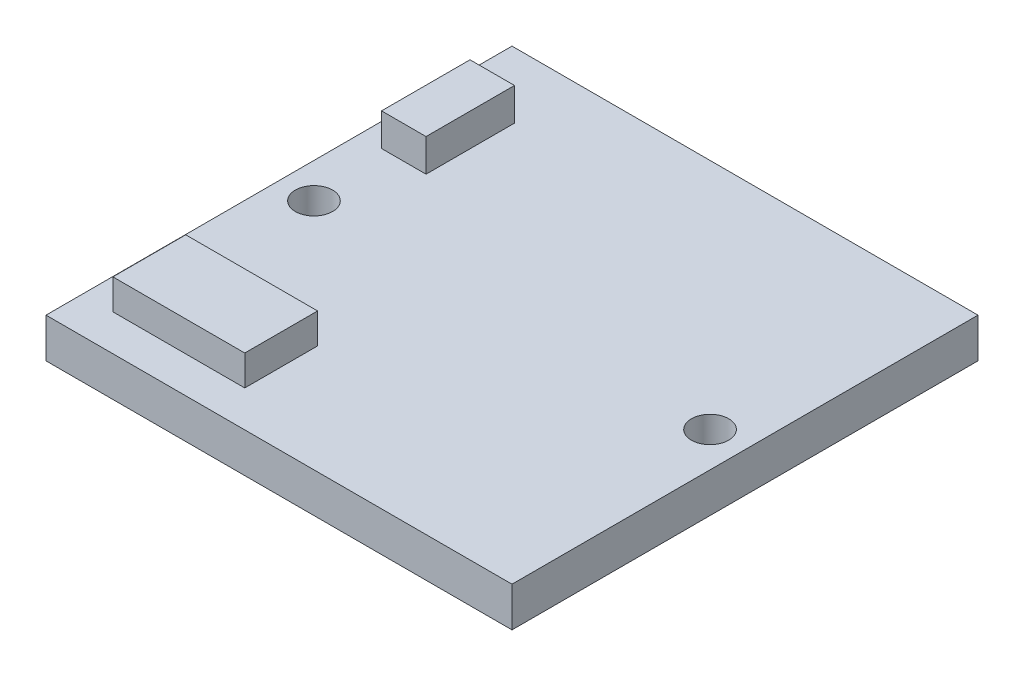
from build123d import *

# Parameters (mm, degrees)
SKETCH_1_W          = 20
SKETCH_1_H          = 20
EXTRUDE_1_DEPTH     = 1.7
SKETCH_2_W          = 0.7
SKETCH_2_H          = 1.5
CUT_EXTRUDE_1_DEPTH = 0.05
SKETCH_3_R          = 0.8
CUT_EXTRUDE_2_DEPTH = 29.335313656
SKETCH_6_W          = 5.659546013
SKETCH_6_H          = 3.125880025
EXTRUDE_4_DEPTH     = 1.3
SKETCH_7_W          = 1.909465354
SKETCH_7_H          = 3.796411433
EXTRUDE_5_DEPTH     = 1.4


with BuildPart() as part:
    # 스케치1 → 보스-돌출1 (new body)
    with BuildSketch(Plane(origin=(0, 0, 0), x_dir=(1, 0, 0), z_dir=(0, 1, 0))):
        with Locations((10, 10)):
            Rectangle(SKETCH_1_W, SKETCH_1_H)
    extrude(amount=EXTRUDE_1_DEPTH)

    # 스케치2 → 컷-돌출1 (cut)
    with BuildSketch(Plane(origin=(0, 0, 0), x_dir=(1, 0, 0), z_dir=(0, 1, 0))):
        with Locations((2.38, 2.75)):
            Rectangle(SKETCH_2_W, SKETCH_2_H)
        with Locations((3.65, 2.75)):
            Rectangle(SKETCH_2_W, SKETCH_2_H)
        with Locations((4.92, 2.75)):
            Rectangle(SKETCH_2_W, SKETCH_2_H)
        with Locations((6.19, 2.75)):
            Rectangle(SKETCH_2_W, SKETCH_2_H)
        with Locations((7.46, 2.75)):
            Rectangle(SKETCH_2_W, SKETCH_2_H)
        with Locations((8.73, 2.75)):
            Rectangle(SKETCH_2_W, SKETCH_2_H)
        with Locations((10, 2.75)):
            Rectangle(SKETCH_2_W, SKETCH_2_H)
        with Locations((11.27, 2.75)):
            Rectangle(SKETCH_2_W, SKETCH_2_H)
        with Locations((12.54, 2.75)):
            Rectangle(SKETCH_2_W, SKETCH_2_H)
        with Locations((13.81, 2.75)):
            Rectangle(SKETCH_2_W, SKETCH_2_H)
        with Locations((15.08, 2.75)):
            Rectangle(SKETCH_2_W, SKETCH_2_H)
        with Locations((16.35, 2.75)):
            Rectangle(SKETCH_2_W, SKETCH_2_H)
        with Locations((17.62, 2.75)):
            Rectangle(SKETCH_2_W, SKETCH_2_H)
    extrude(amount=CUT_EXTRUDE_1_DEPTH, mode=Mode.SUBTRACT)

    # 스케치3 → 컷-돌출2 (cut, through all)
    with BuildSketch(Plane(origin=(0, 1.7, 0), x_dir=(1, 0, 0), z_dir=(0, 1, 0))):
        with Locations(Location((1.5, 10, 0), (0, 0, 270))):
            Circle(SKETCH_3_R)
        with Locations(Location((18.5, 10, 0), (0, 0, 270))):
            Circle(SKETCH_3_R)
    extrude(amount=-CUT_EXTRUDE_2_DEPTH, mode=Mode.SUBTRACT)

    # 스케치6 → 보스-돌출4 (add)
    with BuildSketch(Plane(origin=(0, 1.7, 0), x_dir=(1, 0, 0), z_dir=(0, 1, 0))):
        with Locations((4.142822267, 3.120933029)):
            Rectangle(SKETCH_6_W, SKETCH_6_H)
    extrude(amount=EXTRUDE_4_DEPTH)

    # 스케치7 → 보스-돌출5 (add)
    with BuildSketch(Plane(origin=(0, 1.7, 0), x_dir=(1, 0, 0), z_dir=(0, 1, 0))):
        with Locations((1.96252084, 15.291638164)):
            Rectangle(SKETCH_7_W, SKETCH_7_H)
    extrude(amount=EXTRUDE_5_DEPTH)


solid = part.part
